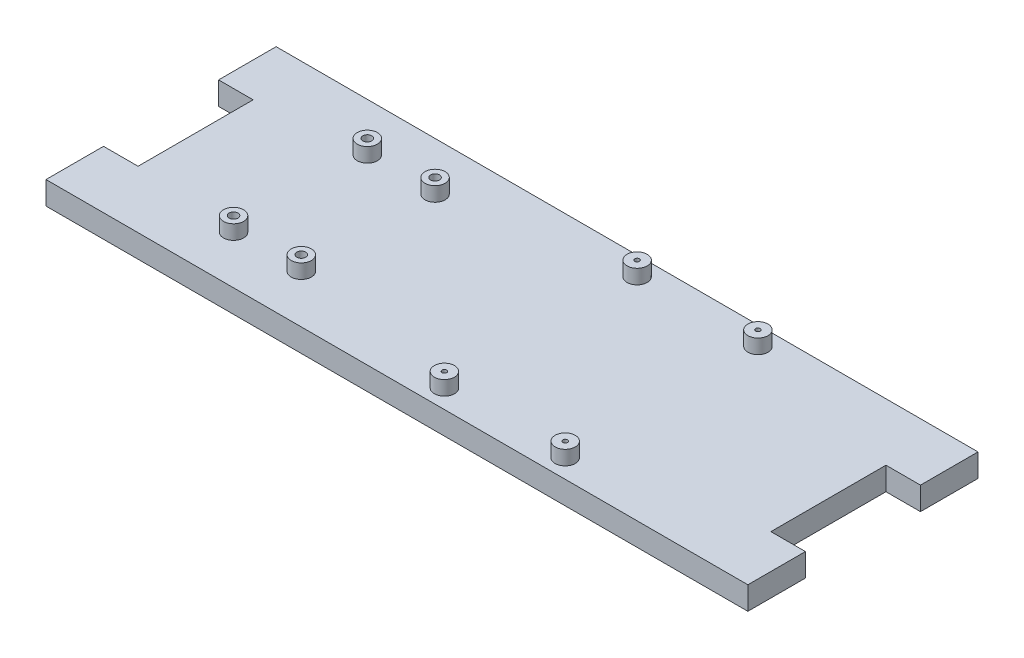
from build123d import *

# Parameters (mm, degrees)
SKETCH2_W                                  = 220
SKETCH2_H                                  = 80
MAIN_DEPTH                                 = 8
SKETCH3_W                                  = 20
SKETCH3_H                                  = 8
TAB_DEPTH                                  = 12
MIRROR1_AT_THE_SECOND_PLANE_COPY_1_SKETC_W = 20
MIRROR1_AT_THE_SECOND_PLANE_COPY_1_SKETC_H = 8
MIRROR1_AT_THE_SECOND_PLANE_COPY_1_DEPTH   = 12
SKETCH4_R                                  = 0.8
SKETCH4_R_2                                = 1.55
PCB_HOLES_DEPTH                            = 129.639029847
PCB_START                                  = 5
SKETCH5_R                                  = 3.5
SKETCH5_R_2                                = 1.55
SKETCH5_R_3                                = 0.8
PCB_PEGS_DEPTH                             = 5


with BuildPart() as part:
    # Sketch2 → Main (new body)
    with BuildSketch(Plane(origin=(0, 0, 0), x_dir=(1, 0, 0), z_dir=(0, 1, 0))):
        Rectangle(SKETCH2_W, SKETCH2_H)
    extrude(amount=MAIN_DEPTH)

    # Sketch3 → Tab (add)
    with BuildSketch(Plane(origin=(110, 0, 0), x_dir=(0, 0, -1), z_dir=(1, 0, 0))):
        with Locations((30, 4)):
            Rectangle(SKETCH3_W, SKETCH3_H)
    tab = extrude(amount=TAB_DEPTH)

    # Mirror1: Tab across plane
    add(tab.mirror(Plane(origin=(0, 0, 0), x_dir=(0, 0, 1), z_dir=(1, 0, 0))))

    # Mirror1 at the second plane: Tab across plane
    add(tab.mirror(Plane.XY))

    # Mirror1 at the second plane copy 1 sketc → Mirror1 at the second plane copy 1 (add)
    with BuildSketch(Plane.ZY.offset(110)):
        with Locations((30, 4)):
            Rectangle(MIRROR1_AT_THE_SECOND_PLANE_COPY_1_SKETC_W, MIRROR1_AT_THE_SECOND_PLANE_COPY_1_SKETC_H)
    extrude(amount=MIRROR1_AT_THE_SECOND_PLANE_COPY_1_DEPTH)

    # Sketch4 → PCB holes (cut, through all)
    with BuildSketch(Plane(origin=(0, 8, 0), x_dir=(1, 0, 0), z_dir=(0, 1, 0))):
        with Locations(Location((10, 33.5, 0), (0, 0, 270))):
            Circle(SKETCH4_R)
        with Locations(Location((52, 33.5, 0), (0, 0, 270))):
            Circle(SKETCH4_R)
        with Locations(Location((52, -33.5, 0), (0, 0, 270))):
            Circle(SKETCH4_R)
        with Locations(Location((10, -33.5, 0), (0, 0, 270))):
            Circle(SKETCH4_R)
        with Locations(Location((-73.55, 23.25, 0), (0, 0, 270))):
            Circle(SKETCH4_R_2)
        with Locations(Location((-50, 23.25, 0), (0, 0, 270))):
            Circle(SKETCH4_R_2)
        with Locations(Location((-50, -23.25, 0), (0, 0, 270))):
            Circle(SKETCH4_R_2)
        with Locations(Location((-73.55, -23.25, 0), (0, 0, 270))):
            Circle(SKETCH4_R_2)
    extrude(amount=-PCB_HOLES_DEPTH, mode=Mode.SUBTRACT)

    # Sketch5 → PCB pegs (add)
    # profile 1 of 8: a face of its own
    with BuildSketch(Plane(origin=(0, 8, 0), x_dir=(1, 0, 0), z_dir=(0, 1, 0)).offset(PCB_START)):
        with Locations(Location((-73.55, 23.25, 0), (0, 0, 270))):
            Circle(SKETCH5_R)
        with Locations(Location((-73.55, 23.25, 0), (0, 0, 270))):
            Circle(SKETCH5_R_2, mode=Mode.SUBTRACT)
    # profile 2 of 8: a face of its own
    with BuildSketch(Plane(origin=(0, 8, 0), x_dir=(1, 0, 0), z_dir=(0, 1, 0)).offset(PCB_START)):
        with Locations(Location((-50, 23.25, 0), (0, 0, 270))):
            Circle(SKETCH5_R)
        with Locations(Location((-50, 23.25, 0), (0, 0, 270))):
            Circle(SKETCH5_R_2, mode=Mode.SUBTRACT)
    # profile 3 of 8: a face of its own
    with BuildSketch(Plane(origin=(0, 8, 0), x_dir=(1, 0, 0), z_dir=(0, 1, 0)).offset(PCB_START)):
        with Locations(Location((-73.55, -23.25, 0), (0, 0, 270))):
            Circle(SKETCH5_R)
        with Locations(Location((-73.55, -23.25, 0), (0, 0, 270))):
            Circle(SKETCH5_R_2, mode=Mode.SUBTRACT)
    # profile 4 of 8: a face of its own
    with BuildSketch(Plane(origin=(0, 8, 0), x_dir=(1, 0, 0), z_dir=(0, 1, 0)).offset(PCB_START)):
        with Locations(Location((-50, -23.25, 0), (0, 0, 270))):
            Circle(SKETCH5_R)
        with Locations(Location((-50, -23.25, 0), (0, 0, 270))):
            Circle(SKETCH5_R_2, mode=Mode.SUBTRACT)
    # profile 5 of 8: a face of its own
    with BuildSketch(Plane(origin=(0, 8, 0), x_dir=(1, 0, 0), z_dir=(0, 1, 0)).offset(PCB_START)):
        with Locations(Location((10, -33.5, 0), (0, 0, 270))):
            Circle(SKETCH5_R)
        with Locations(Location((10, -33.5, 0), (0, 0, 270))):
            Circle(SKETCH5_R_3, mode=Mode.SUBTRACT)
    # profile 6 of 8: a face of its own
    with BuildSketch(Plane(origin=(0, 8, 0), x_dir=(1, 0, 0), z_dir=(0, 1, 0)).offset(PCB_START)):
        with Locations(Location((52, -33.5, 0), (0, 0, 270))):
            Circle(SKETCH5_R)
        with Locations(Location((52, -33.5, 0), (0, 0, 270))):
            Circle(SKETCH5_R_3, mode=Mode.SUBTRACT)
    # profile 7 of 8: a face of its own
    with BuildSketch(Plane(origin=(0, 8, 0), x_dir=(1, 0, 0), z_dir=(0, 1, 0)).offset(PCB_START)):
        with Locations(Location((52, 33.5, 0), (0, 0, 270))):
            Circle(SKETCH5_R)
        with Locations(Location((52, 33.5, 0), (0, 0, 270))):
            Circle(SKETCH5_R_3, mode=Mode.SUBTRACT)
    # profile 8 of 8: a face of its own
    with BuildSketch(Plane(origin=(0, 8, 0), x_dir=(1, 0, 0), z_dir=(0, 1, 0)).offset(PCB_START)):
        with Locations(Location((10, 33.5, 0), (0, 0, 270))):
            Circle(SKETCH5_R)
        with Locations(Location((10, 33.5, 0), (0, 0, 270))):
            Circle(SKETCH5_R_3, mode=Mode.SUBTRACT)
    extrude(amount=-PCB_PEGS_DEPTH)


solid = part.part
